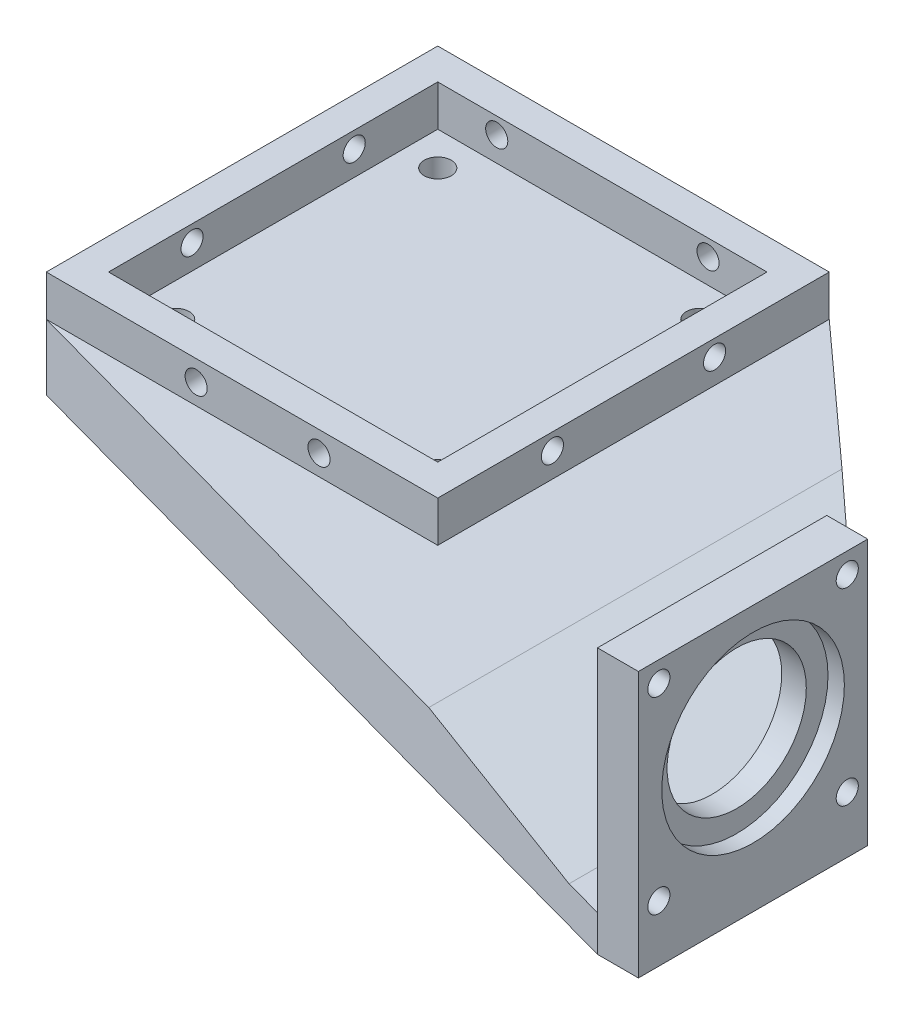
from build123d import *

# Parameters (mm, degrees)
SKETCH1_W            = 47.8
SKETCH1_H            = 47.8
SKETCH1_W_2          = 40.2
SKETCH1_H_2          = 40.2
BOSS_EXTRUDE1_DEPTH  = 5
CUT_EXTRUDE4_REACH   = 55.675
SKETCH6_R            = 1.35
CUT_EXTRUDE5_REACH   = 55.675
SKETCH7_R            = 1.35
SKETCH8_R            = 1.35
CUT_EXTRUDE6_DEPTH   = 54.675413366
SKETCH11_R           = 1.65
BOSS_EXTRUDE8_DEPTH  = 8
CUT_EXTRUDE7_DEPTH   = 105.393965343
SKETCH12_W           = 28
SKETCH12_H           = 28
SKETCH12_R           = 1.35
SKETCH12_R_2         = 11.15
BOSS_EXTRUDE9_DEPTH  = 5
BOSS_EXTRUDE10_START = -2
SKETCH12_3_R         = 11.15
SKETCH12_3_R_2       = 8.5
BOSS_EXTRUDE10_DEPTH = 3


with BuildPart() as part:
    # Sketch1 → Boss-Extrude1 (new body)
    with BuildSketch(Plane(origin=(0, 0, 0), x_dir=(1, 0, 0), z_dir=(0, 1, 0))):
        Rectangle(SKETCH1_W, SKETCH1_H)
        Rectangle(SKETCH1_W_2, SKETCH1_H_2, mode=Mode.SUBTRACT)
    extrude(amount=BOSS_EXTRUDE1_DEPTH)

    # Sketch6 → Cut-Extrude4 (cut, up to next)
    with BuildSketch(Plane(origin=(0, 0, -23.9), x_dir=(-1, 0, 0), z_dir=(0, 0, -1)), mode=Mode.PRIVATE) as cut_extrude4_sk1:
        with Locations((-12.9, 3)):
            Circle(SKETCH6_R)
    cut_extrude4_tool1 = extrude(cut_extrude4_sk1.sketch, amount=-CUT_EXTRUDE4_REACH, mode=Mode.PRIVATE) & part.part
    # Sketch6 → Cut-Extrude4 (cut, up to next)
    with BuildSketch(Plane(origin=(0, 0, -23.9), x_dir=(-1, 0, 0), z_dir=(0, 0, -1)), mode=Mode.PRIVATE) as cut_extrude4_sk2:
        with Locations((12.9, 3)):
            Circle(SKETCH6_R)
    cut_extrude4_tool2 = extrude(cut_extrude4_sk2.sketch, amount=-CUT_EXTRUDE4_REACH, mode=Mode.PRIVATE) & part.part
    add(cut_extrude4_tool1.solids().sort_by_distance((12.9, 3, -23.9))[0], mode=Mode.SUBTRACT)
    add(cut_extrude4_tool2.solids().sort_by_distance((-12.9, 3, -23.9))[0], mode=Mode.SUBTRACT)

    # Sketch7 → Cut-Extrude5 (cut, up to next)
    with BuildSketch(Plane.XY.offset(23.9), mode=Mode.PRIVATE) as cut_extrude5_sk1:
        with Locations((9.4, 2.5)):
            Circle(SKETCH7_R)
    cut_extrude5_tool1 = extrude(cut_extrude5_sk1.sketch, amount=-CUT_EXTRUDE5_REACH, mode=Mode.PRIVATE) & part.part
    # Sketch7 → Cut-Extrude5 (cut, up to next)
    with BuildSketch(Plane.XY.offset(23.9), mode=Mode.PRIVATE) as cut_extrude5_sk2:
        with Locations((-5.6, 2.5)):
            Circle(SKETCH7_R)
    cut_extrude5_tool2 = extrude(cut_extrude5_sk2.sketch, amount=-CUT_EXTRUDE5_REACH, mode=Mode.PRIVATE) & part.part
    add(cut_extrude5_tool1.solids().sort_by_distance((9.4, 2.5, 23.9))[0], mode=Mode.SUBTRACT)
    add(cut_extrude5_tool2.solids().sort_by_distance((-5.6, 2.5, 23.9))[0], mode=Mode.SUBTRACT)

    # Sketch8 → Cut-Extrude6 (cut, through all)
    with BuildSketch(Plane(origin=(23.9, 0, 0), x_dir=(0, 0, -1), z_dir=(1, 0, 0))):
        with Locations((-9.9, 3)):
            Circle(SKETCH8_R)
        with Locations((9.9, 3)):
            Circle(SKETCH8_R)
    extrude(amount=-CUT_EXTRUDE6_DEPTH, mode=Mode.SUBTRACT)

    # Sketch11 → Boss-Extrude8 (add)
    with BuildSketch(Plane(origin=(0, 0, 0), x_dir=(1, 0, 0), z_dir=(0, 1, 0))):
        Polygon((73.9, -49.4), (73.9, -21.4), (23.9, 23.9), (-23.9, 23.9), (-23.9, -23.9), (68.9, -49.4), align=None)
        with Locations((16, 16)):
            Circle(SKETCH11_R, mode=Mode.SUBTRACT)
        with Locations((-16, 16)):
            Circle(SKETCH11_R, mode=Mode.SUBTRACT)
        with Locations((-16, -16)):
            Circle(SKETCH11_R, mode=Mode.SUBTRACT)
        with Locations((16, -16)):
            Circle(SKETCH11_R, mode=Mode.SUBTRACT)
    extrude(amount=-BOSS_EXTRUDE8_DEPTH)

    # Sketch13 → Cut-Extrude7 (cut, through all)
    with BuildSketch(Plane.XY.offset(49.4)):
        Polygon((73.9, -3.587183479), (64.114380232, -3.587183479), (28.73812358, 1.78739259), (73.9, 1.78739259), align=None)
    extrude(amount=-CUT_EXTRUDE7_DEPTH, mode=Mode.SUBTRACT)

    # Sketch12 → Boss-Extrude9 (add)
    with BuildSketch(Plane(origin=(73.9, 0, 0), x_dir=(0, 0, -1), z_dir=(1, 0, 0))):
        with Locations((-35.4, 10.412816521)):
            Rectangle(SKETCH12_W, SKETCH12_H)
        with Locations((-46.9, -1.087183479)):
            Circle(SKETCH12_R, mode=Mode.SUBTRACT)
        with Locations((-35.4, 10.412816521)):
            Circle(SKETCH12_R_2, mode=Mode.SUBTRACT)
        with Locations((-23.9, -1.087183479)):
            Circle(SKETCH12_R, mode=Mode.SUBTRACT)
        with Locations((-46.9, 21.912816521)):
            Circle(SKETCH12_R, mode=Mode.SUBTRACT)
        with Locations((-23.9, 21.912816521)):
            Circle(SKETCH12_R, mode=Mode.SUBTRACT)
    extrude(amount=-BOSS_EXTRUDE9_DEPTH)

    # Sketch12<3> → Boss-Extrude10 (add)
    with BuildSketch(Plane(origin=(73.9, 0, 0), x_dir=(0, 0, -1), z_dir=(1, 0, 0)).offset(BOSS_EXTRUDE10_START)):
        with Locations((-35.4, 10.412816521)):
            Circle(SKETCH12_3_R)
        with Locations((-35.4, 10.412816521)):
            Circle(SKETCH12_3_R_2, mode=Mode.SUBTRACT)
    extrude(amount=-BOSS_EXTRUDE10_DEPTH)


solid = part.part
